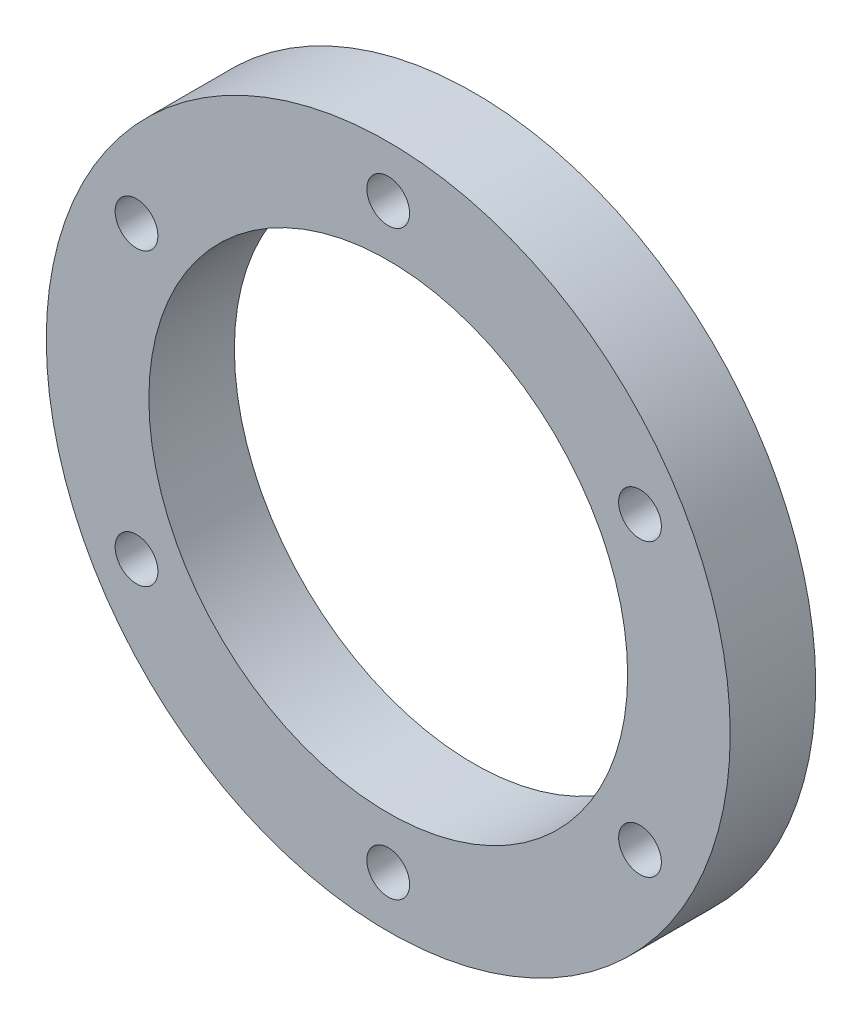
from build123d import *

# Parameters (mm, degrees)
SKETCH1_R           = 20
SKETCH1_R_2         = 1.25
SKETCH1_R_3         = 14
BOSS_EXTRUDE1_DEPTH = 5


with BuildPart() as part:
    # Sketch1 → Boss-Extrude1 (new body)
    with BuildSketch(Plane.XY):
        Circle(SKETCH1_R)
        with Locations((0, 17)):
            Circle(SKETCH1_R_2, mode=Mode.SUBTRACT)
        with Locations((14.722431864, 8.5)):
            Circle(SKETCH1_R_2, mode=Mode.SUBTRACT)
        with Locations((14.722431864, -8.5)):
            Circle(SKETCH1_R_2, mode=Mode.SUBTRACT)
        with Locations((0, -17)):
            Circle(SKETCH1_R_2, mode=Mode.SUBTRACT)
        with Locations((-14.722431864, -8.5)):
            Circle(SKETCH1_R_2, mode=Mode.SUBTRACT)
        with Locations((-14.722431864, 8.5)):
            Circle(SKETCH1_R_2, mode=Mode.SUBTRACT)
        Circle(SKETCH1_R_3, mode=Mode.SUBTRACT)
    extrude(amount=BOSS_EXTRUDE1_DEPTH)


solid = part.part
